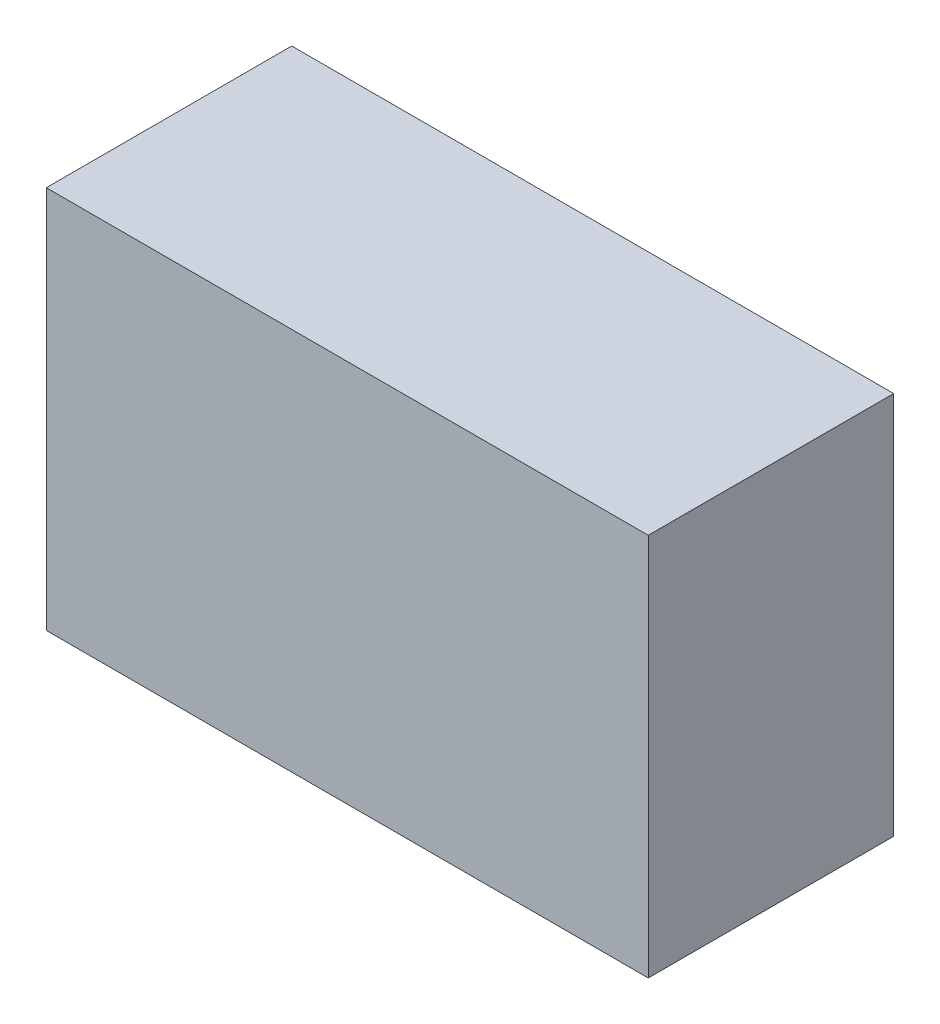
from build123d import *

# Parameters (mm, degrees)
SKETCH3_W                      = 31.148374891
SKETCH3_H                      = 19.837641971
BOSS_EXTRUDE1_DEPTH            = 6.35
SKETCH4_R                      = 3.175
CUT_EXTRUDE1_DEPTH             = 9.525
SKETCH5_R                      = 3.175
CUT_EXTRUDE5_DEPTH             = 9.525
CUT_EXTRUDE5_DIRECTION_2_REACH = 33.299
SKETCH6_R                      = 3.175
CUT_EXTRUDE6_DEPTH             = 9.525


with BuildPart() as part:
    # Sketch3 → Boss-Extrude1 (new, symmetric)
    with BuildSketch(Plane.XY):
        with Locations((15.574187446, -9.918820986)):
            Rectangle(SKETCH3_W, SKETCH3_H)
    extrude(amount=BOSS_EXTRUDE1_DEPTH, both=True)

    # Sketch4 → Cut-Extrude1 (cut)
    with BuildSketch(Plane.ZY):
        with Locations(Location((0, -6.35, 0), (0, 0, 270))):
            Circle(SKETCH4_R)
    extrude(amount=-CUT_EXTRUDE1_DEPTH, mode=Mode.SUBTRACT)

    # Sketch5 → Cut-Extrude5 (cut)
    with BuildSketch(Plane(origin=(7.787093723, -19.837641971, 0), x_dir=(-0.8660254037844382, 0.500000000000001, 0), z_dir=(-0.500000000000001, -0.8660254037844382, 0))):
        with Locations(Location((0, 0, 0), (0, 0, 180))):
            Circle(SKETCH5_R)
    cut_extrude5 = extrude(amount=-CUT_EXTRUDE5_DEPTH, mode=Mode.SUBTRACT)

    # Sketch5 → Cut-Extrude5 direction 2 (cut, up to next)
    with BuildSketch(Plane(origin=(7.787093723, -19.837641971, 0), x_dir=(-0.8660254037844382, 0.500000000000001, 0), z_dir=(-0.500000000000001, -0.8660254037844382, 0)), mode=Mode.PRIVATE) as cut_extrude5_direction_2_sk1:
        with Locations(Location((0, 0, 0), (0, 0, 180))):
            Circle(SKETCH5_R)
    cut_extrude5_direction_2_tool1 = extrude(cut_extrude5_direction_2_sk1.sketch, amount=CUT_EXTRUDE5_DIRECTION_2_REACH, mode=Mode.PRIVATE) & part.part
    cut_extrude5_direction_2 = cut_extrude5_direction_2_tool1.solids().sort_by_distance((7.787094, -19.837642, 0))[0]
    add(cut_extrude5_direction_2, mode=Mode.SUBTRACT)

    # Sketch6 → Cut-Extrude6 (cut)
    with BuildSketch(Plane(origin=(0, 0, -6.35), x_dir=(-1, 0, 0), z_dir=(0, 0, -1))):
        with Locations((-15.574187445, -6.35)):
            Circle(SKETCH6_R)
    extrude(amount=-CUT_EXTRUDE6_DEPTH, mode=Mode.SUBTRACT)

    # Mirror1: Cut-Extrude5, Cut-Extrude5 direction 2 across plane
    add(cut_extrude5.mirror(Plane.ZY.offset(-15.574187445)), mode=Mode.SUBTRACT)
    add(cut_extrude5_direction_2.mirror(Plane.ZY.offset(-15.574187445)), mode=Mode.SUBTRACT)


solid = part.part
